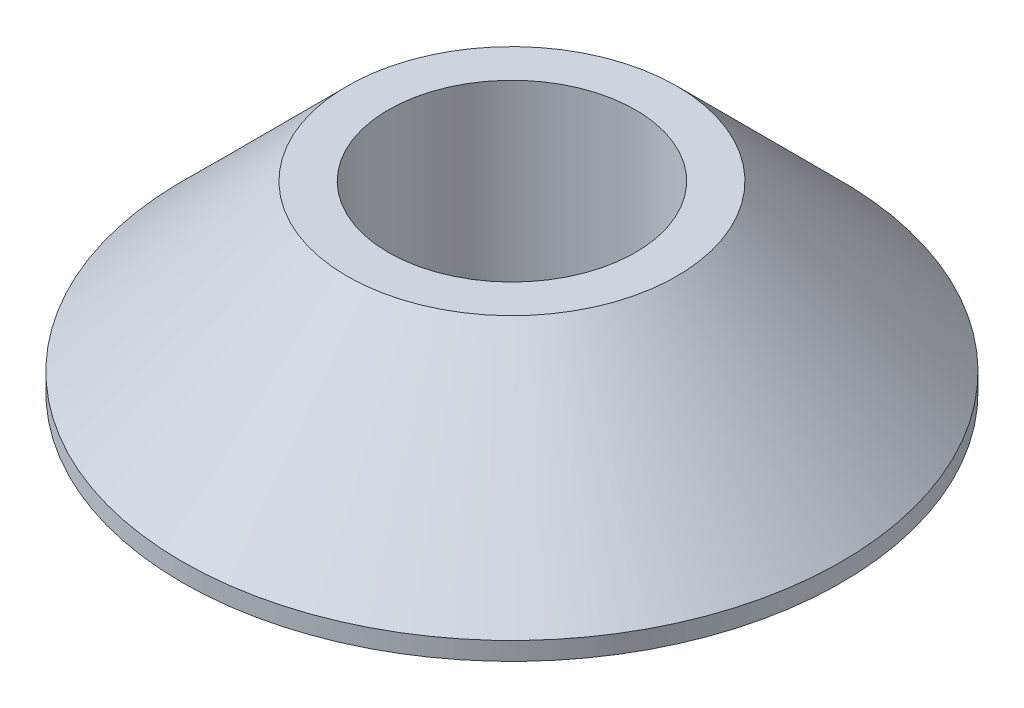
from build123d import *

# Parameters (mm, degrees)
SKETCH1_R           = 12.7
BOSS_EXTRUDE1_DEPTH = 0.6985
SKETCH2_R           = 12.7
BOSS_EXTRUDE2_DEPTH = 6.35
BOSS_EXTRUDE2_TAPER = 45
SKETCH3_R           = 4.7625
CUT_EXTRUDE1_DEPTH  = 20.294075706


with BuildPart() as part:
    # Sketch1 → Boss-Extrude1 (new body)
    with BuildSketch(Plane(origin=(0, 0, 0), x_dir=(1, 0, 0), z_dir=(0, 1, 0))):
        with Locations(Location((0, 0, 0), (0, 0, 270))):
            Circle(SKETCH1_R)
    extrude(amount=BOSS_EXTRUDE1_DEPTH)

    # Sketch2 → Boss-Extrude2 (add)
    with BuildSketch(Plane(origin=(0, 0.6985, 0), x_dir=(1, 0, 0), z_dir=(0, 1, 0))):
        with Locations(Location((0, 0, 0), (0, 0, 270))):
            Circle(SKETCH2_R)
    extrude(amount=BOSS_EXTRUDE2_DEPTH, taper=BOSS_EXTRUDE2_TAPER)

    # Sketch3 → Cut-Extrude1 (cut, through all)
    with BuildSketch(Plane(origin=(0, 7.0485, 0), x_dir=(1, 0, 0), z_dir=(0, 1, 0))):
        with Locations(Location((0, 0, 0), (0, 0, 270))):
            Circle(SKETCH3_R)
    extrude(amount=-CUT_EXTRUDE1_DEPTH, mode=Mode.SUBTRACT)


solid = part.part
